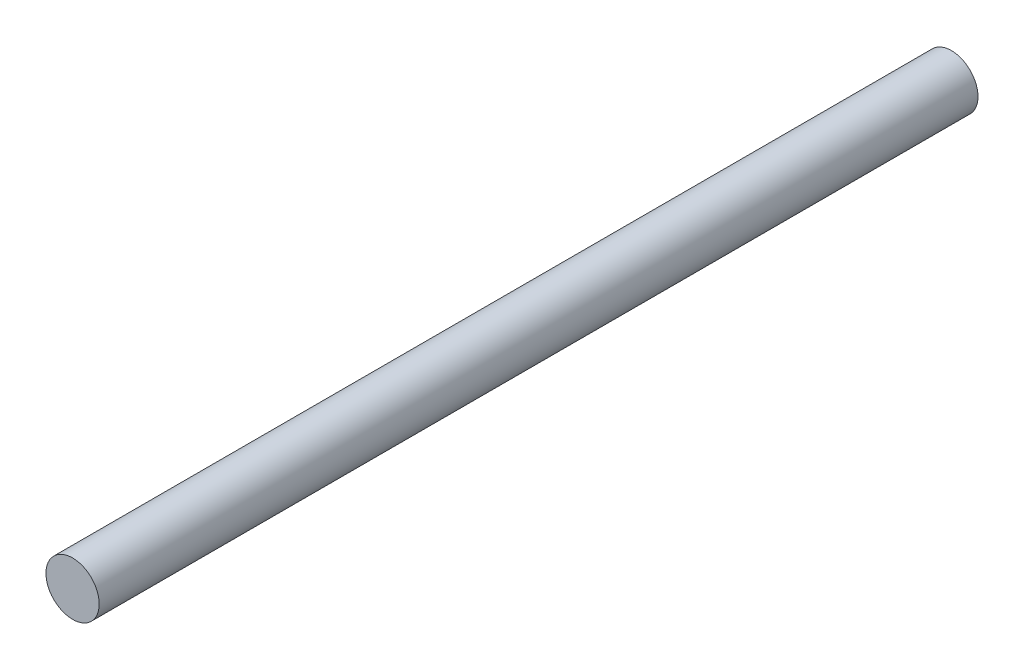
from build123d import *

# Parameters (mm, degrees)
SKETCH1_R           = 2
BOSS_EXTRUDE1_DEPTH = 33


with BuildPart() as part:
    # Sketch1 → Boss-Extrude1 (new, symmetric)
    with BuildSketch(Plane.XY):
        Circle(SKETCH1_R)
    extrude(amount=BOSS_EXTRUDE1_DEPTH, both=True)


solid = part.part
